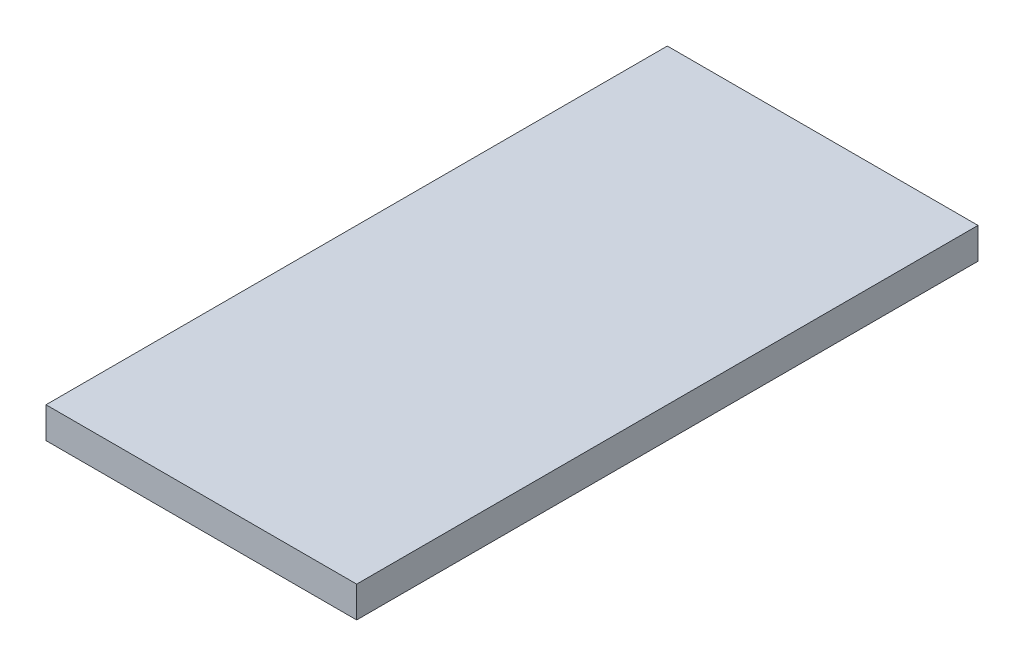
from build123d import *

# Parameters (mm, degrees)
SKETCH1_W           = 5
SKETCH1_H           = 10
BOSS_EXTRUDE1_DEPTH = 0.5


with BuildPart() as part:
    # Sketch1 → Boss-Extrude1 (new body)
    with BuildSketch(Plane(origin=(0, 0, 0), x_dir=(1, 0, 0), z_dir=(0, 1, 0))):
        with Locations((2.5, 5)):
            Rectangle(SKETCH1_W, SKETCH1_H)
    extrude(amount=BOSS_EXTRUDE1_DEPTH)


solid = part.part
